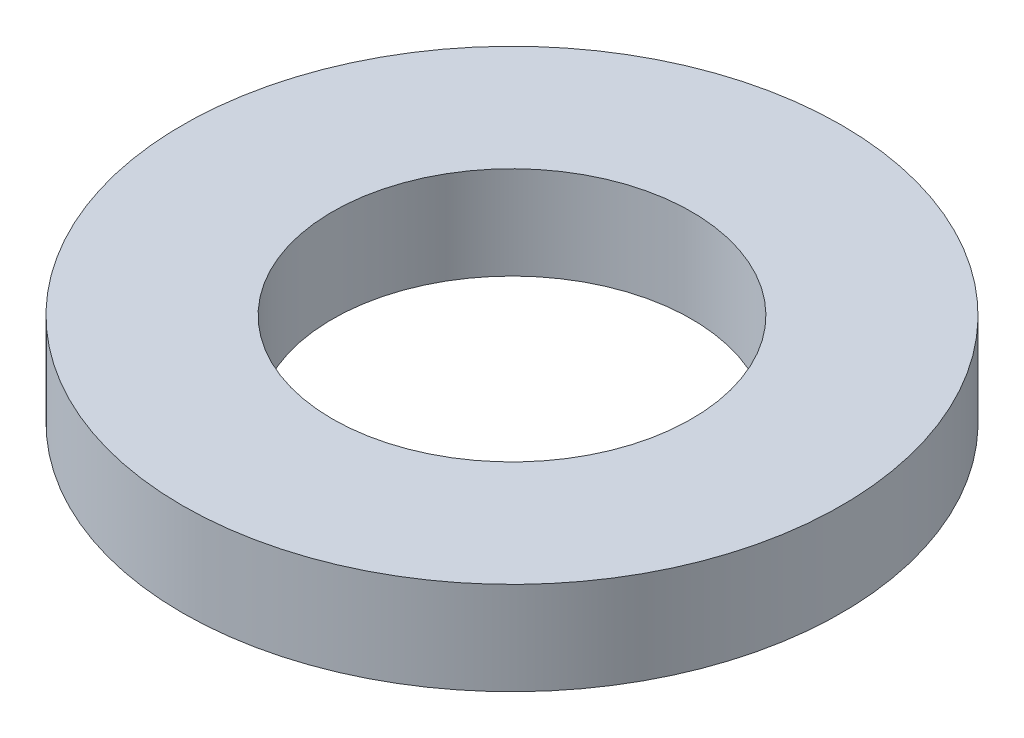
from build123d import *

# Parameters (mm, degrees)
SKETCH1_R           = 5.9436
BOSS_EXTRUDE1_DEPTH = 1.6764
SKETCH5_R           = 3.2385
CUT_EXTRUDE1_DEPTH  = 9.571060546


with BuildPart() as part:
    # Sketch1 → Boss-Extrude1 (new body)
    with BuildSketch(Plane(origin=(0, 0, 0), x_dir=(1, 0, 0), z_dir=(0, 1, 0))):
        with Locations(Location((0, 0, 0), (0, 0, 270))):
            Circle(SKETCH1_R)
    extrude(amount=BOSS_EXTRUDE1_DEPTH)

    # Sketch5 → Cut-Extrude1 (cut, through all)
    with BuildSketch(Plane(origin=(0, 1.6764, 0), x_dir=(-1, 0, 0), z_dir=(0, 1, 0))):
        with Locations(Location((0, 0, 0), (0, 0, 90))):
            Circle(SKETCH5_R)
    extrude(amount=-CUT_EXTRUDE1_DEPTH, mode=Mode.SUBTRACT)


solid = part.part
